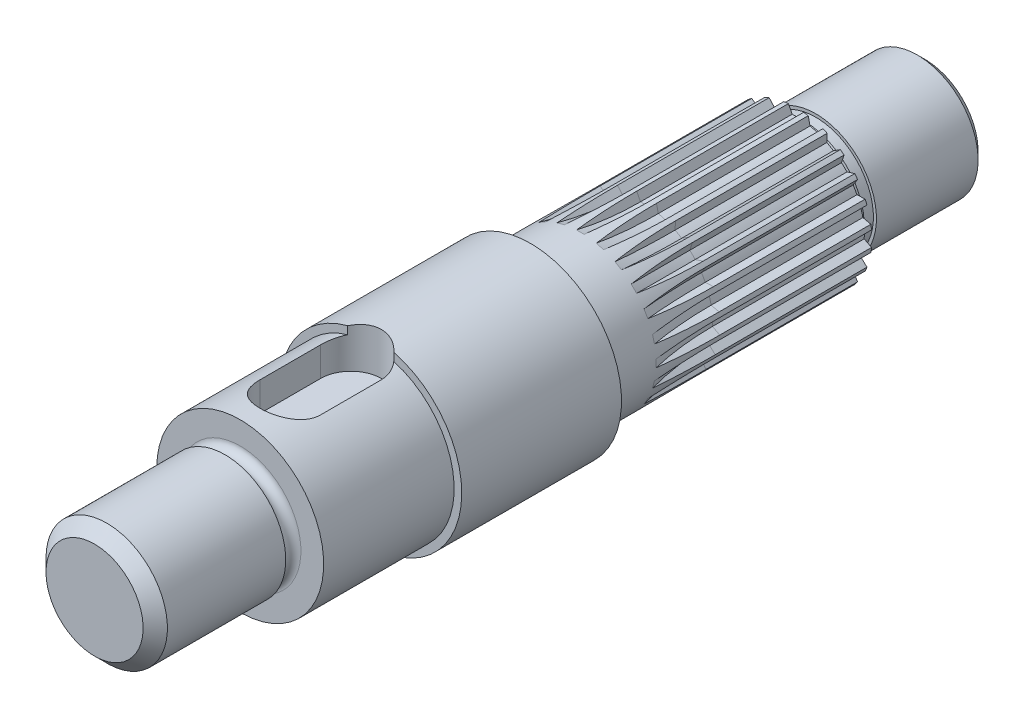
from build123d import *

# Parameters (mm, degrees)
ENL_V_MAT_EXTRU_1_DEPTH      = 64.99955078
R_P_TITION_CIRCULAIRE1_COUNT = 24


with BuildPart() as part:
    # Esquisse1 → Révolution1 (revolve)
    with BuildSketch(Plane(origin=(0, 0, 0), x_dir=(0, 0, -1), z_dir=(1, 0, 0))):
        with BuildLine():
            Line((-63.05, 0), (-63.05, 3.2))
            Line((-63.05, 3.2), (-62.25, 4))
            Line((-62.25, 4), (-54.45, 4))
            ThreePointArc((-54.45, 4), (-53.95, 3.5), (-53.45, 4))
            Line((-53.45, 4), (-53.45, 5.5))
            Line((-53.45, 5.5), (-44.85, 5.5))
            Line((-44.85, 5.5), (-44.85, 6))
            Line((-44.85, 6), (-34.32, 6))
            Line((-34.32, 6), (-34.32, 5))
            Line((-34.32, 5), (-16.82, 5))
            Line((-16.82, 5), (-16.82, 4))
            Line((-16.82, 4), (-16.32, 4))
            Line((-16.32, 4), (-16.32, 3.8))
            Line((-16.32, 3.8), (-15.52, 3.8))
            Line((-15.52, 3.8), (-15.52, 4))
            Line((-15.52, 4), (-8.82, 4))
            Line((-8.82, 4), (-8.32, 3.5))
            Line((-8.32, 3.5), (-8.32, 0))
            Line((-8.32, 0), (-63.05, 0))
        make_face()
    revolve(axis=Axis((0, 0, 0), (0, 0, 1)))

    # Esquisse2 → Enlèv. mat.-Extru.1 (cut, through all)
    with BuildSketch(Plane(origin=(0, 3.2, 0), x_dir=(1, 0, 0), z_dir=(0, 1, 0))):
        with BuildLine():
            Line((2, -46.15), (2, -50.15))
            ThreePointArc((2, -50.15), (0, -52.15), (-2, -50.15))
            Line((-2, -50.15), (-2, -46.15))
            ThreePointArc((-2, -46.15), (0, -44.15), (2, -46.15))
        make_face()
    extrude(amount=ENL_V_MAT_EXTRU_1_DEPTH, mode=Mode.SUBTRACT)

    # Enlèvement de matière-Balayage1: sweep along a path in Esquisse5
    with BuildLine(Plane(origin=(0, 0, 0), x_dir=(0, 0, -1), z_dir=(1, 0, 0))) as enl_vement_de_mati_re_balayage1_path:
        Line((-16.82, 4.5), (-26.82, 4.5))
        ThreePointArc((-26.82, 4.5), (-36.306832981, 7.202941459), (-42.944515497, 14.5))
    # Esquisse4 → Enlèvement de matière-Balayage1 (sweep, cut)
    with BuildSketch(Plane(origin=(0, 0, 16.82), x_dir=(-1, 0, 0), z_dir=(0, 0, -1))):
        with BuildLine():
            Line((-0.5, 4.974937186), (-0.25, 4.493050189))
            ThreePointArc((-0.25, 4.493050189), (0, 4.5), (0.25, 4.493050189))
            Line((0.25, 4.493050189), (0.5, 4.974937186))
            ThreePointArc((0.5, 4.974937186), (0, 5), (-0.5, 4.974937186))
        make_face()
    enl_vement_de_mati_re_balayage1 = sweep(path=enl_vement_de_mati_re_balayage1_path.line, mode=Mode.SUBTRACT)

    # Répétition circulaire1: Enlèvement de matière-Balayage1 ×24 about axis
    r_p_tition_circulaire1_axis = Axis((0, 0, 0), (0, 0, 1))
    for i in range(1, R_P_TITION_CIRCULAIRE1_COUNT):
        add(enl_vement_de_mati_re_balayage1.rotate(r_p_tition_circulaire1_axis, i * 360 / R_P_TITION_CIRCULAIRE1_COUNT), mode=Mode.SUBTRACT)


solid = part.part
